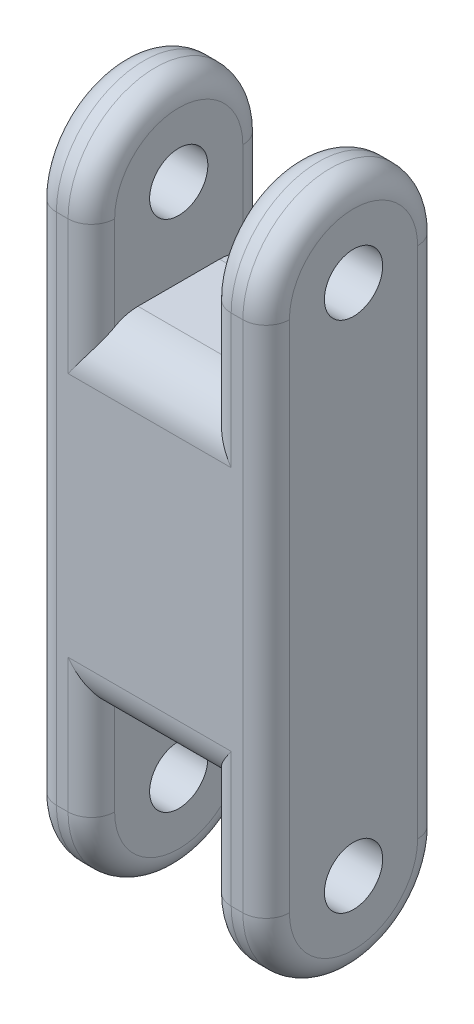
from build123d import *

# Parameters (mm, degrees)
BOSS_EXTRUDE1_DEPTH = 12.7
SKETCH2_R           = 1.5875
CUT_EXTRUDE1_DEPTH  = 19.05
CUT_EXTRUDE2_DEPTH  = 3.175
FILLET2_R           = 2.54
FILLET3_R           = 1.27
SKETCH3_R           = 1.086795662
BOSS_EXTRUDE2_DEPTH = 2.54
FILLET4_R           = 0.762
SKETCH4_R           = 0.491571792
CUT_EXTRUDE3_DEPTH  = 2.54


with BuildPart() as part:
    # Sketch1 → Boss-Extrude1 (new body)
    with BuildSketch(Plane(origin=(0, 0, 0), x_dir=(0, 0, -1), z_dir=(1, 0, 0))):
        with BuildLine():
            Line((-4.7625, 0), (-4.7625, 27.9908))
            ThreePointArc((-4.7625, 27.9908), (0, 32.7533), (4.7625, 27.9908))
            Line((4.7625, 27.9908), (4.7625, 0))
            ThreePointArc((4.7625, 0), (0, -4.7625), (-4.7625, 0))
        make_face()
    extrude(amount=BOSS_EXTRUDE1_DEPTH)

    # Sketch2 → Cut-Extrude1 (cut)
    with BuildSketch(Plane(origin=(12.7, 0, 0), x_dir=(0, 0, -1), z_dir=(1, 0, 0))):
        Circle(SKETCH2_R)
        with Locations((0, 27.9908)):
            Circle(SKETCH2_R)
    extrude(amount=-CUT_EXTRUDE1_DEPTH, mode=Mode.SUBTRACT)

    # 3DSketch1 → Cut-Extrude2 (cut, symmetric)
    with BuildSketch(Plane(origin=(6.35, 27.9908, -4.7625), x_dir=(0, -0.9466889316456175, 0.322149137356721), z_dir=(1, 0, 0))):
        with BuildLine():
            Line((0, 0), (4.508606037, 1.534235267))
            Line((4.508606037, 1.534235267), (7.57707657, -7.482976807))
            Line((7.57707657, -7.482976807), (3.068470533, -9.017212074))
            ThreePointArc((3.068470533, -9.017212074), (-2.97437077, -6.042841304), (0, 0))
        make_face()
        with BuildLine():
            Line((29.567051081, 0), (25.058445044, -1.534235267))
            Line((25.058445044, -1.534235267), (21.989974511, 7.482976807))
            Line((21.989974511, 7.482976807), (26.498580548, 9.017212074))
            ThreePointArc((26.498580548, 9.017212074), (32.541421852, 6.042841304), (29.567051081, 0))
        make_face()
    extrude(amount=CUT_EXTRUDE2_DEPTH, both=True, mode=Mode.SUBTRACT)

    # Fillet2
    fillet2_edges = [part.edges().sort_by_distance(p)[0] for p in [
        (6.35, 23.2283, -4.7625),
        (6.35, 4.7625, -4.7625),
        (6.35, 4.7625, 4.7625),
        (6.35, 23.2283, 4.7625),
    ]]
    fillet(fillet2_edges, radius=FILLET2_R)

    # Fillet3
    fillet3_edges = [part.edges().sort_by_distance(p)[0] for p in [
        (12.7, 32.7533, 0),
        (12.7, 13.9954, 4.7625),
        (9.525, 24.33955, 4.7625),
        (9.525, 24.33955, -4.7625),
        (3.175, 24.33955, -4.7625),
        (3.175, 24.33955, 4.7625),
        (12.7, -4.7625, 0),
        (0, 13.9954, 4.7625),
        (0, 32.7533, 0),
        (9.525, 3.65125, -4.7625),
        (9.525, 3.65125, 4.7625),
        (0, 13.9954, -4.7625),
        (3.175, 3.65125, 4.7625),
        (3.175, 3.65125, -4.7625),
        (0, -4.7625, 0),
        (12.7, 13.9954, -4.7625),
    ]]
    fillet(fillet3_edges, radius=FILLET3_R)

    # Sketch3 → Boss-Extrude2 (add)
    with BuildSketch(Plane.ZY):
        with Locations((-2.225739377, 2.096022994)):
            Circle(SKETCH3_R)
    extrude(amount=BOSS_EXTRUDE2_DEPTH)

    # Fillet4
    fillet4_edges = [part.edges().sort_by_distance(p)[0] for p in [
        (-2.54, 2.096022994, -3.312535039),
    ]]
    fillet(fillet4_edges, radius=FILLET4_R)

    # Sketch4 → Cut-Extrude3 (cut)
    with BuildSketch(Plane(origin=(0, 3.476983319, -2.007437255), x_dir=(-1, 0, 0), z_dir=(0, 0.8660254037844399, -0.4999999999999979))):
        with Locations(Location((0.856605906, -0.806785971, 0), (0, 0, 90))):
            Circle(SKETCH4_R)
    extrude(amount=-CUT_EXTRUDE3_DEPTH, mode=Mode.SUBTRACT)


solid = part.part
